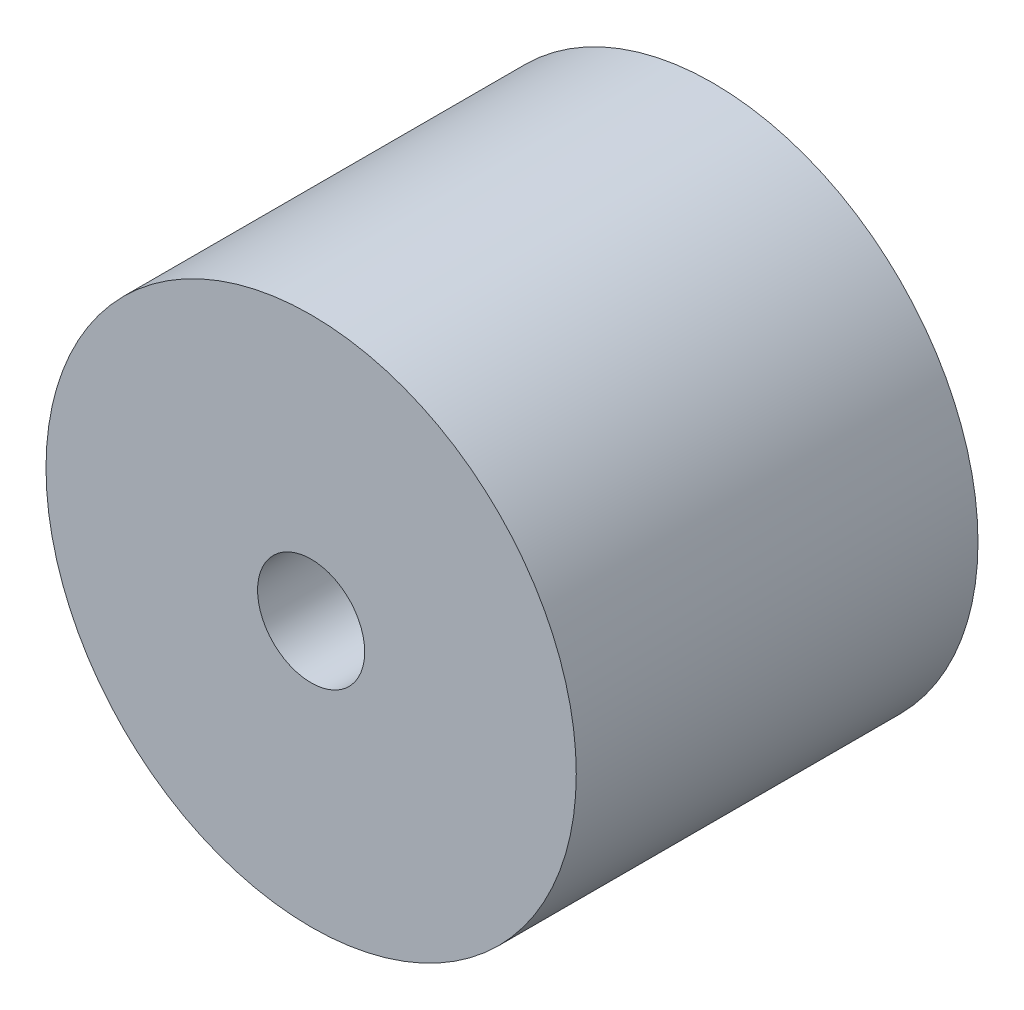
from build123d import *

# Parameters (mm, degrees)
SKETCH_1_R      = 9.9
SKETCH_1_R_2    = 2
EXTRUDE_1_DEPTH = 15


with BuildPart() as part:
    # 草图1 → 凸台-拉伸1 (new body)
    with BuildSketch(Plane.XY):
        Circle(SKETCH_1_R)
        Circle(SKETCH_1_R_2, mode=Mode.SUBTRACT)
    extrude(amount=EXTRUDE_1_DEPTH)


solid = part.part
